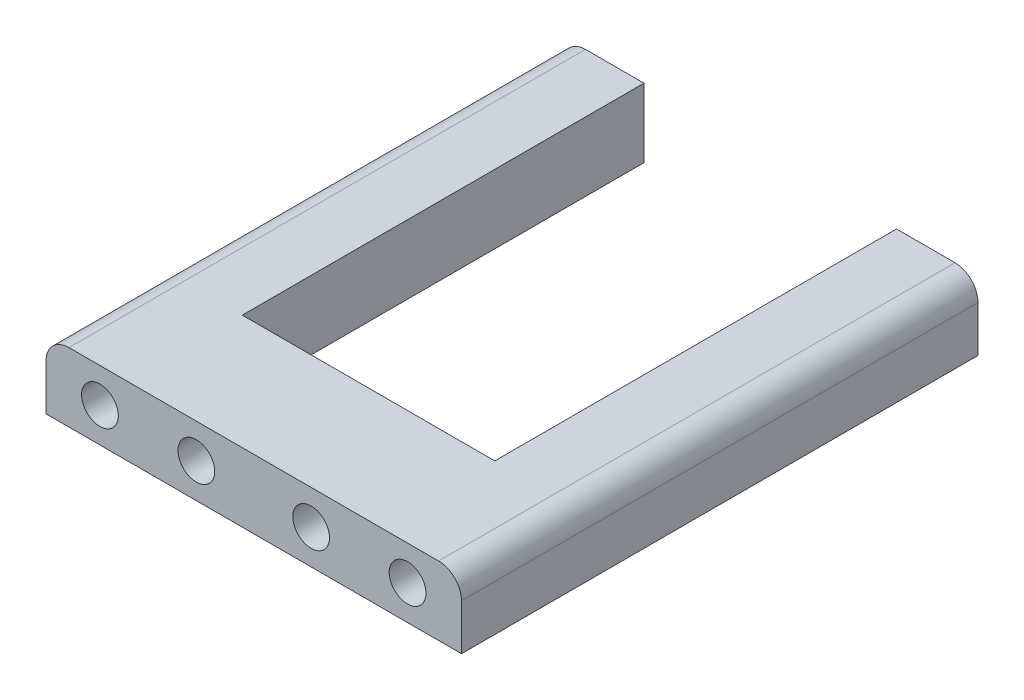
from build123d import *

# Parameters (mm, degrees)
SKETCH1_W           = 36.2
SKETCH1_H           = 45
BOSS_EXTRUDE1_DEPTH = 6
SKETCH2_R           = 1.6
CUT_EXTRUDE1_DEPTH  = 49.873407902
SKETCH4_W           = 22
SKETCH4_H           = 6
CUT_EXTRUDE2_DEPTH  = 35
FILLET1_R           = 2


with BuildPart() as part:
    # Sketch1 → Boss-Extrude1 (new body)
    with BuildSketch(Plane(origin=(0, 0, 0), x_dir=(1, 0, 0), z_dir=(0, 1, 0))):
        Rectangle(SKETCH1_W, SKETCH1_H)
    extrude(amount=BOSS_EXTRUDE1_DEPTH)

    # Sketch2 → Cut-Extrude1 (cut, through all)
    with BuildSketch(Plane.XY.offset(22.5)):
        with Locations((-5, 3)):
            Circle(SKETCH2_R)
        with Locations((-13.4, 3)):
            Circle(SKETCH2_R)
        with Locations((5, 3)):
            Circle(SKETCH2_R)
        with Locations((13.4, 3)):
            Circle(SKETCH2_R)
    extrude(amount=-CUT_EXTRUDE1_DEPTH, mode=Mode.SUBTRACT)

    # Sketch4 → Cut-Extrude2 (cut)
    with BuildSketch(Plane(origin=(0, 0, -22.5), x_dir=(-1, 0, 0), z_dir=(0, 0, -1))):
        with Locations((0, 3)):
            Rectangle(SKETCH4_W, SKETCH4_H)
    extrude(amount=-CUT_EXTRUDE2_DEPTH, mode=Mode.SUBTRACT)

    # Fillet1
    fillet1_edges = [part.edges().sort_by_distance(p)[0] for p in [
        (-18.1, 6, 0),
        (18.1, 6, 0),
    ]]
    fillet(fillet1_edges, radius=FILLET1_R)


solid = part.part
